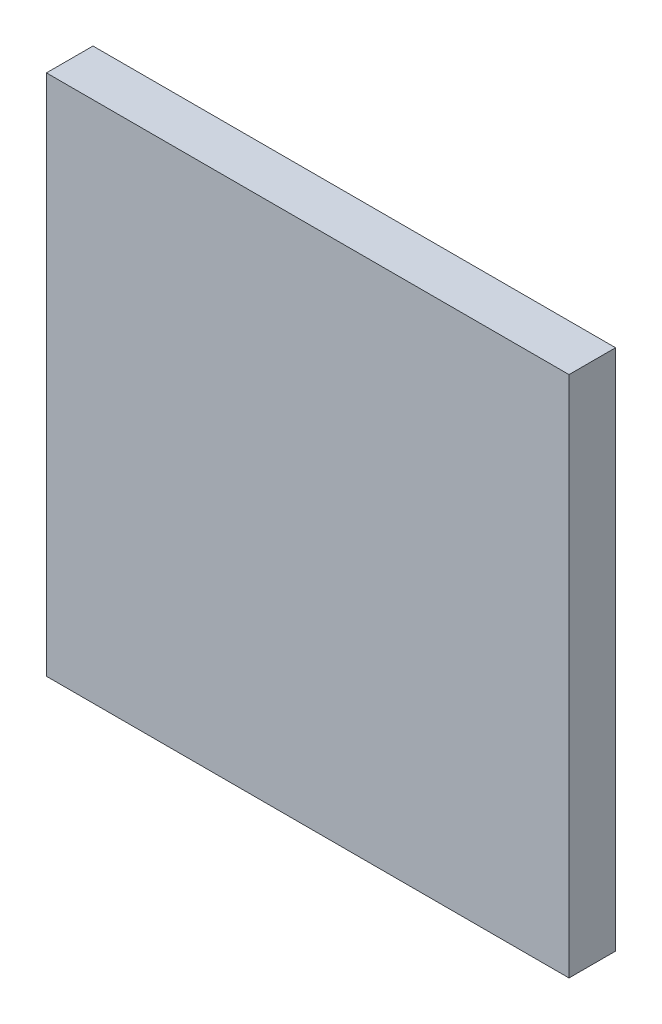
from build123d import *

# Parameters (mm, degrees)
SKETCH1_W      = 37.5
SKETCH1_H      = 37.5
EXTRUDE1_DEPTH = 3.34


with BuildPart() as part:
    # Sketch1 → Extrude1 (new body)
    with BuildSketch(Plane.XY):
        with Locations((-78.94, -68.75)):
            Rectangle(SKETCH1_W, SKETCH1_H)
    extrude(amount=EXTRUDE1_DEPTH)


solid = part.part
